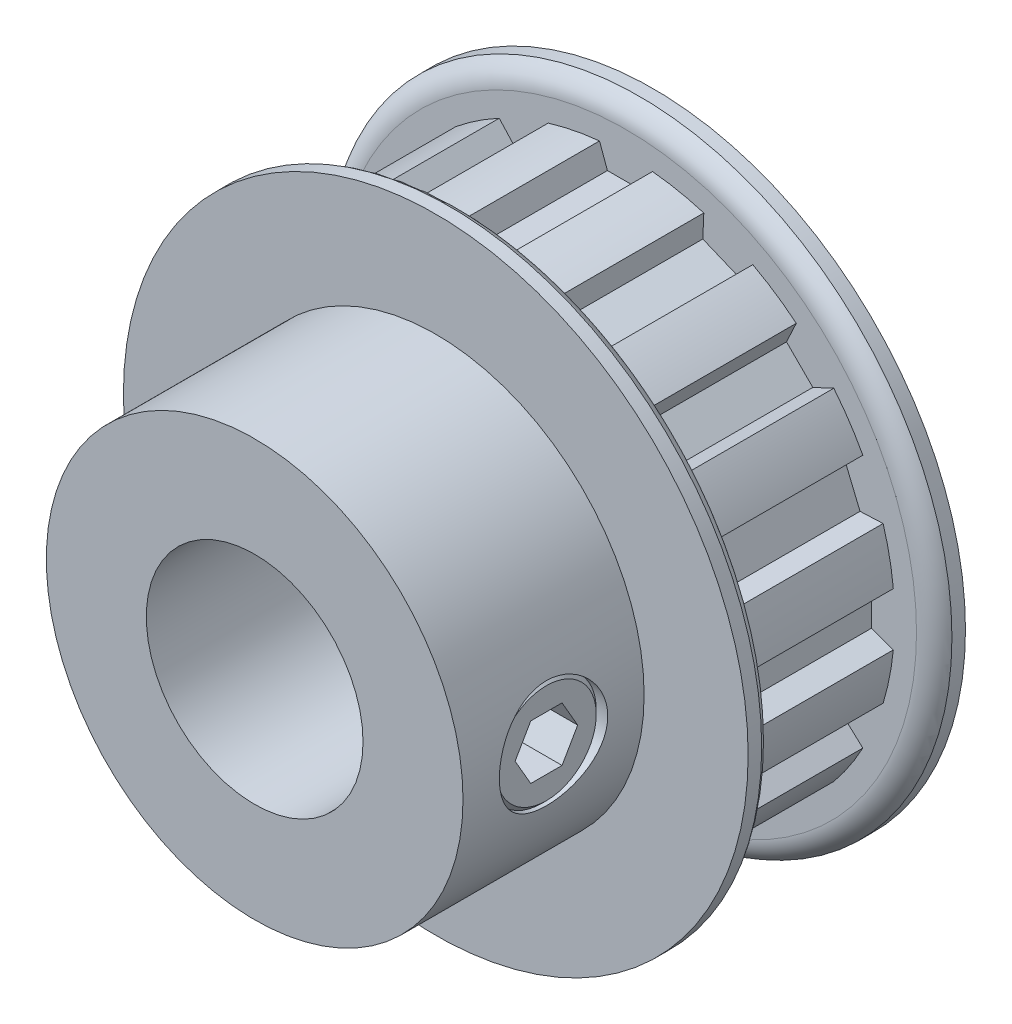
from build123d import *

# Parameters (mm, degrees)
CUT_EXTRUDE1_START = -0.7874
CUT_EXTRUDE1_DEPTH = 14.3002
CIRPATTERN1_COUNT  = 16
SKETCH4_R          = 4.75
CUT_EXTRUDE2_DEPTH = 43.478219515
CUT_EXTRUDE3_DEPTH = 3.5625


with BuildPart() as part:
    # Sketch2 → Revolve1 (revolve)
    with BuildSketch(Plane(origin=(0, 0, 0), x_dir=(0, 0, -1), z_dir=(1, 0, 0)), mode=Mode.PRIVATE) as revolve1_sk:
        with BuildLine():
            Line((-17.4625, 9.5), (17.4625, 9.5))
            Line((17.4625, 9.5), (17.4625, 27.3812))
            Line((17.4625, 27.3812), (16.27505, 27.3812))
            ThreePointArc((16.27505, 27.3812), (15.408504076, 26.591481572), (15.0876, 25.463839073))
            Line((15.0876, 25.463839073), (15.0876, 23.546478146))
            Line((15.0876, 23.546478146), (0.7874, 23.546478146))
            Line((0.7874, 23.546478146), (0.7874, 25.463839073))
            ThreePointArc((0.7874, 25.463839073), (0.466495924, 26.591481572), (-0.40005, 27.3812))
            Line((-0.40005, 27.3812), (-1.5875, 27.3812))
            Line((-1.5875, 27.3812), (-1.5875, 18.2626))
            Line((-1.5875, 18.2626), (-17.4625, 18.2626))
            Line((-17.4625, 18.2626), (-17.4625, 9.5))
        make_face()
    revolve(revolve1_sk.sketch.rotate(Axis((0, 0, 17.4625), (0, 0, -1)), 90), axis=Axis((0, 0, 17.4625), (0, 0, -1)))

    # Sketch3 → Cut-Extrude1 (cut)
    with BuildSketch(Plane.XY.offset(CUT_EXTRUDE1_START)):
        with BuildLine():
            Line((-1.630736704, 21.5265), (1.630736704, 21.5265))
            Line((1.630736704, 21.5265), (2.3241, 23.4315))
            ThreePointArc((2.3241, 23.4315), (0, 23.546478146), (-2.3241, 23.4315))
            Line((-2.3241, 23.4315), (-1.630736704, 21.5265))
        make_face()
    cut_extrude1 = extrude(amount=-CUT_EXTRUDE1_DEPTH, mode=Mode.SUBTRACT)

    # CirPattern1: Cut-Extrude1 ×16 about axis
    cirpattern1_axis = Axis((0, 0, 0), (0, 0, 1))
    for i in range(1, CIRPATTERN1_COUNT):
        add(cut_extrude1.rotate(cirpattern1_axis, i * 360 / CIRPATTERN1_COUNT), mode=Mode.SUBTRACT)

    # Sketch4 → Cut-Extrude2 (cut, through all)
    with BuildSketch(Plane(origin=(0, 0, 0), x_dir=(0, -1, 0), z_dir=(1, 0, 0))):
        with Locations(Location((0, -9.525, 0), (0, 0, 270))):
            Circle(SKETCH4_R)
    extrude(amount=CUT_EXTRUDE2_DEPTH, mode=Mode.SUBTRACT)

    # Sketch5 → Revolve2 (revolve)
    with BuildSketch(Plane.XY.offset(9.525)):
        Polygon((9.5, -4.369), (9.5, 0), (17.634059622, 0), (17.634059622, -4.369), (17.253059622, -4.75), (9.881, -4.75), align=None)
    revolve(axis=Axis((9.5, 0, 9.525), (1, 0, 0)))

    # Sketch6 → Cut-Extrude3 (cut)
    with BuildSketch(Plane(origin=(17.634059622, 5.384140679, 0), x_dir=(0, -1, 0), z_dir=(-1, 0, 0))):
        Polygon((5.384140679, 12.267413779), (3.009140679, 10.896206889), (3.009140679, 8.153793111), (5.384140679, 6.782586221), (7.759140679, 8.153793111), (7.759140679, 10.896206889), align=None)
    extrude(amount=CUT_EXTRUDE3_DEPTH, mode=Mode.SUBTRACT)


solid = part.part
